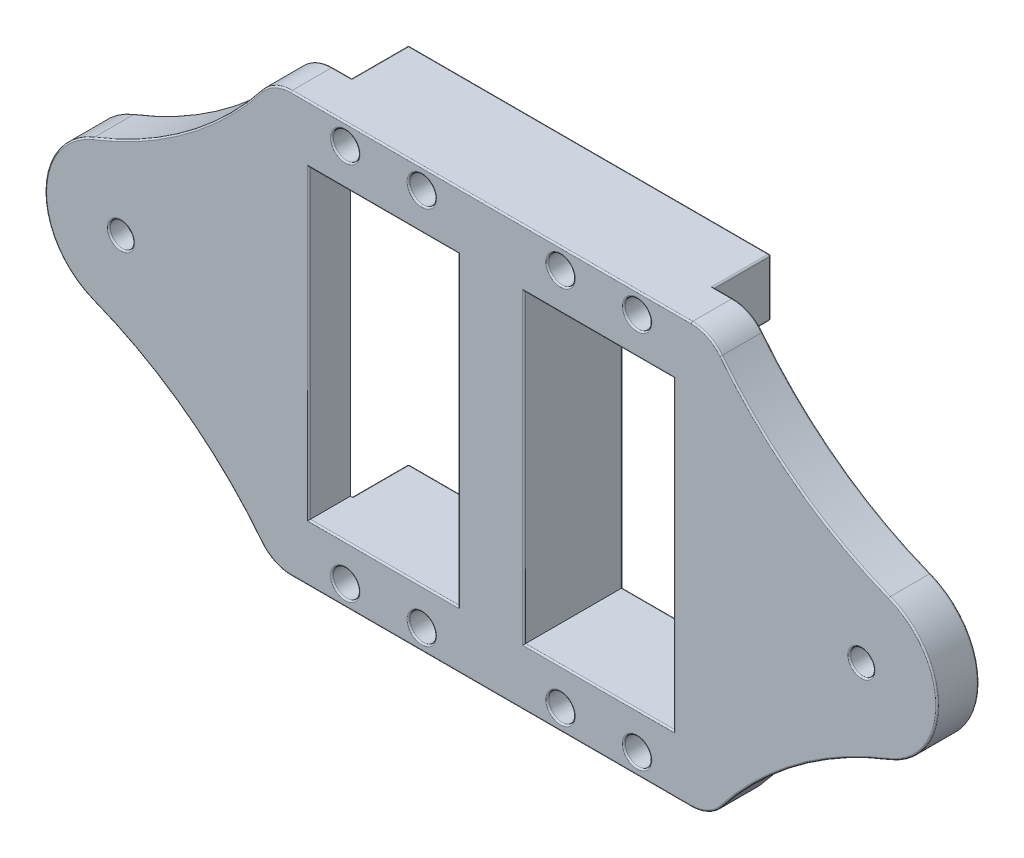
from build123d import *

# Parameters (mm, degrees)
SKETCH_1_R          = 1.1
EXTRUDE_1_DEPTH     = 7.5
SKETCH_2_W          = 19.4
SKETCH_2_H          = 40
SKETCH_2_R          = 1.6
SKETCH_2_R_2        = 1.1
EXTRUDE_2_DEPTH     = 5.5
CUT_EXTRUDE_1_DEPTH = 3
SKETCH_4_R          = 1.75
CUT_EXTRUDE_2_DEPTH = 3
SKETCH_5_W          = 19.7
SKETCH_5_H          = 40.3
SKETCH_5_W_2        = 19.4
SKETCH_5_H_2        = 40
CUT_EXTRUDE_3_DEPTH = 67.331790952
FILLET_1_R          = 0.2


with BuildPart() as part:
    # 스케치1 → 보스-돌출1 (new body)
    with BuildSketch(Plane.XY):
        Polygon((-4.5, -20), (-4.5, 20), (-23.9, 20), (-23.9, 27.7), (23.9, 27.7), (23.9, 20), (4.5, 20), (4.5, -20), (23.9, -20), (23.9, -27.7), (-23.9, -27.7), (-23.9, -20), align=None)
        with Locations((-19.25, 25)):
            Circle(SKETCH_1_R, mode=Mode.SUBTRACT)
        with Locations((-19.25, -25)):
            Circle(SKETCH_1_R, mode=Mode.SUBTRACT)
        with Locations((-9.15, -25)):
            Circle(SKETCH_1_R, mode=Mode.SUBTRACT)
        with Locations((19.25, -25)):
            Circle(SKETCH_1_R, mode=Mode.SUBTRACT)
        with Locations((19.25, 25)):
            Circle(SKETCH_1_R, mode=Mode.SUBTRACT)
        with Locations((9.15, 25)):
            Circle(SKETCH_1_R, mode=Mode.SUBTRACT)
        with Locations((9.15, -25)):
            Circle(SKETCH_1_R, mode=Mode.SUBTRACT)
        with Locations((-9.15, 25)):
            Circle(SKETCH_1_R, mode=Mode.SUBTRACT)
    extrude(amount=EXTRUDE_1_DEPTH)

    # 스케치2 → 보스-돌출2 (add)
    with BuildSketch(Plane.XY.offset(7.5)):
        with BuildLine():
            Line((-26.399088842, -27.7), (26.399088842, -27.7))
            ThreePointArc((26.399088842, -27.7), (28.585937154, -27.196409063), (30.332274669, -25.787077784))
            ThreePointArc((30.332274669, -25.787077784), (40.311933029, -16.066097966), (52.497014243, -9.312223123))
            ThreePointArc((52.497014243, -9.312223123), (58.852497745, 0), (52.497014243, 9.312223123))
            ThreePointArc((52.497014243, 9.312223123), (40.311933029, 16.066097966), (30.332274669, 25.787077784))
            ThreePointArc((30.332274669, 25.787077784), (28.585937154, 27.196409063), (26.399088842, 27.7))
            Line((26.399088842, 27.7), (-26.399088842, 27.7))
            ThreePointArc((-26.399088842, 27.7), (-28.585937154, 27.196409063), (-30.332274669, 25.787077784))
            ThreePointArc((-30.332274669, 25.787077784), (-40.311933029, 16.066097966), (-52.497014243, 9.312223123))
            ThreePointArc((-52.497014243, 9.312223123), (-58.852497745, 0), (-52.497014243, -9.312223123))
            ThreePointArc((-52.497014243, -9.312223123), (-40.311933029, -16.066097966), (-30.332274669, -25.787077784))
            ThreePointArc((-30.332274669, -25.787077784), (-28.585937154, -27.196409063), (-26.399088842, -27.7))
        make_face()
        with Locations((14.2, 0)):
            Rectangle(SKETCH_2_W, SKETCH_2_H, mode=Mode.SUBTRACT)
        with Locations((-14.2, 0)):
            Rectangle(SKETCH_2_W, SKETCH_2_H, mode=Mode.SUBTRACT)
        with Locations((-48.852497745, 0)):
            Circle(SKETCH_2_R, mode=Mode.SUBTRACT)
        with Locations((9.15, 25)):
            Circle(SKETCH_2_R_2, mode=Mode.SUBTRACT)
        with Locations((19.25, 25)):
            Circle(SKETCH_2_R_2, mode=Mode.SUBTRACT)
        with Locations((-19.25, -25)):
            Circle(SKETCH_2_R_2, mode=Mode.SUBTRACT)
        with Locations((-9.15, -25)):
            Circle(SKETCH_2_R_2, mode=Mode.SUBTRACT)
        with Locations((9.15, -25)):
            Circle(SKETCH_2_R_2, mode=Mode.SUBTRACT)
        with Locations((19.25, -25)):
            Circle(SKETCH_2_R_2, mode=Mode.SUBTRACT)
        with Locations((-19.25, 25)):
            Circle(SKETCH_2_R_2, mode=Mode.SUBTRACT)
        with Locations((-9.15, 25)):
            Circle(SKETCH_2_R_2, mode=Mode.SUBTRACT)
        with Locations((48.852497745, 0)):
            Circle(SKETCH_2_R, mode=Mode.SUBTRACT)
    extrude(amount=EXTRUDE_2_DEPTH)

    # 스케치3 → 컷-돌출1 (cut)
    with BuildSketch(Plane(origin=(0, 0, 7.5), x_dir=(-1, 0, 0), z_dir=(0, 0, -1))):
        Polygon((-48.852497745, -3.18), (-46.098536961, -1.59), (-46.098536961, 1.59), (-48.852497745, 3.18), (-51.60645853, 1.59), (-51.60645853, -1.59), align=None)
        Polygon((48.852497745, -3.18), (46.098536961, -1.59), (46.098536961, 1.59), (48.852497745, 3.18), (51.60645853, 1.59), (51.60645853, -1.59), align=None)
    extrude(amount=-CUT_EXTRUDE_1_DEPTH, mode=Mode.SUBTRACT)

    # 스케치4 → 컷-돌출2 (cut)
    with BuildSketch(Plane.XY.offset(13)):
        with Locations((-19.25, 25)):
            Circle(SKETCH_4_R)
        with Locations((-9.15, 25)):
            Circle(SKETCH_4_R)
        with Locations((9.15, 25)):
            Circle(SKETCH_4_R)
        with Locations((19.25, 25)):
            Circle(SKETCH_4_R)
        with Locations((-19.25, -25)):
            Circle(SKETCH_4_R)
        with Locations((-9.15, -25)):
            Circle(SKETCH_4_R)
        with Locations((9.15, -25)):
            Circle(SKETCH_4_R)
        with Locations((19.25, -25)):
            Circle(SKETCH_4_R)
    extrude(amount=-CUT_EXTRUDE_2_DEPTH, mode=Mode.SUBTRACT)

    # 스케치5 → 컷-돌출3 (cut, through all)
    # profile 1 of 3: a face of its own
    with BuildSketch(Plane.XY.offset(13)):
        with Locations((-14.2, 0)):
            Rectangle(SKETCH_5_W, SKETCH_5_H)
        with Locations((-14.2, 0)):
            Rectangle(SKETCH_5_W_2, SKETCH_5_H_2, mode=Mode.SUBTRACT)
    # profile 2 of 3: a face of its own
    with BuildSketch(Plane.XY.offset(13)):
        with Locations((14.2, 0)):
            Rectangle(SKETCH_5_W, SKETCH_5_H)
        with Locations((14.2, 0)):
            Rectangle(SKETCH_5_W_2, SKETCH_5_H_2, mode=Mode.SUBTRACT)
    # profile 3 of 3: a face of its own
    with BuildSketch(Plane.XY.offset(13)):
        with Locations((-14.2, 0)):
            Rectangle(SKETCH_5_W_2, SKETCH_5_H_2)
    extrude(amount=-CUT_EXTRUDE_3_DEPTH, mode=Mode.SUBTRACT)

    # 필렛1
    fillet_1_edges = [part.edges().sort_by_distance(p)[0] for p in [
        (47.252497745, 0, 10.5),
        (50.229478137, -2.385, 7.5),
        (47.475517353, -2.385, 7.5),
        (46.098536961, 0, 7.5),
        (47.475517353, 2.385, 7.5),
        (50.229478137, 2.385, 7.5),
        (51.60645853, 0, 7.5),
        (-50.452497745, 0, 10.5),
        (-50.229478137, -2.385, 7.5),
        (-51.60645853, 0, 7.5),
        (-50.229478137, 2.385, 7.5),
        (-47.475517353, 2.385, 7.5),
        (-46.098536961, 0, 7.5),
        (-47.475517353, -2.385, 7.5),
        (-20.35, -25, 10),
        (-21, -25, 13),
        (18.15, 25, 10),
        (17.5, 25, 13),
        (8.05, 25, 10),
        (7.4, 25, 13),
        (-10.9, 25, 13),
        (-10.25, 25, 10),
        (-10.25, -25, 10),
        (-10.9, -25, 13),
        (7.4, -25, 13),
        (8.05, -25, 10),
        (17.5, -25, 13),
        (18.15, -25, 10),
        (-21, 25, 13),
        (-20.35, 25, 10),
        (-10.25, 25, 0),
        (8.05, -25, 0),
        (8.05, 25, 0),
        (0, 27.7, 0),
        (0, -27.7, 0),
        (-23.9, 23.925, 0),
        (23.9, 23.925, 0),
        (23.9, -23.925, 0),
        (-23.9, -23.925, 0),
        (-14.125, 20.15, 0),
        (-4.35, 0, 0),
        (-14.125, -20.15, 0),
        (-14.2, -20.15, 13),
        (-23.9, 20.15, 3.75),
        (-14.2, 20.15, 13),
        (-4.35, 0, 13),
        (-23.9, -20.15, 3.75),
        (-24.05, 0, 13),
        (18.15, 25, 0),
        (18.15, -25, 0),
        (14.2, 20.15, 13),
        (4.35, 0, 13),
        (-10.25, -25, 0),
        (23.9, 20.15, 3.75),
        (23.9, -20.15, 3.75),
        (14.2, -20.15, 13),
        (14.125, -20.15, 0),
        (4.35, 0, 0),
        (14.125, 20.15, 0),
        (24.05, 0, 13),
        (-20.35, -25, 0),
        (-20.35, 25, 0),
        (-23.9, 27.7, 3.75),
        (23.9, 27.7, 3.75),
        (23.9, -27.7, 3.75),
        (-23.9, -27.7, 3.75),
        (-25.149544421, -27.7, 7.5),
        (-28.585937154, -27.196409063, 7.5),
        (-58.852497745, 0, 7.5),
        (-40.311933029, 16.066097966, 7.5),
        (25.149544421, 27.7, 7.5),
        (-25.149544421, 27.7, 7.5),
        (-28.585937154, 27.196409063, 7.5),
        (-40.311933029, 16.066097966, 13),
        (-58.852497745, 0, 13),
        (-40.311933029, -16.066097966, 7.5),
        (-28.585937154, -27.196409063, 13),
        (0, -27.7, 13),
        (28.585937154, -27.196409063, 7.5),
        (40.311933029, -16.066097966, 13),
        (58.852497745, 0, 7.5),
        (40.311933029, 16.066097966, 7.5),
        (28.585937154, 27.196409063, 13),
        (47.252497745, 0, 13),
        (-50.452497745, 0, 13),
        (0, 27.7, 13),
        (-28.585937154, 27.196409063, 13),
        (-40.311933029, -16.066097966, 13),
        (28.585937154, -27.196409063, 13),
        (58.852497745, 0, 13),
        (40.311933029, 16.066097966, 13),
        (28.585937154, 27.196409063, 7.5),
        (40.311933029, -16.066097966, 7.5),
        (25.149544421, -27.7, 7.5),
    ]]
    fillet(fillet_1_edges, radius=FILLET_1_R)


solid = part.part
